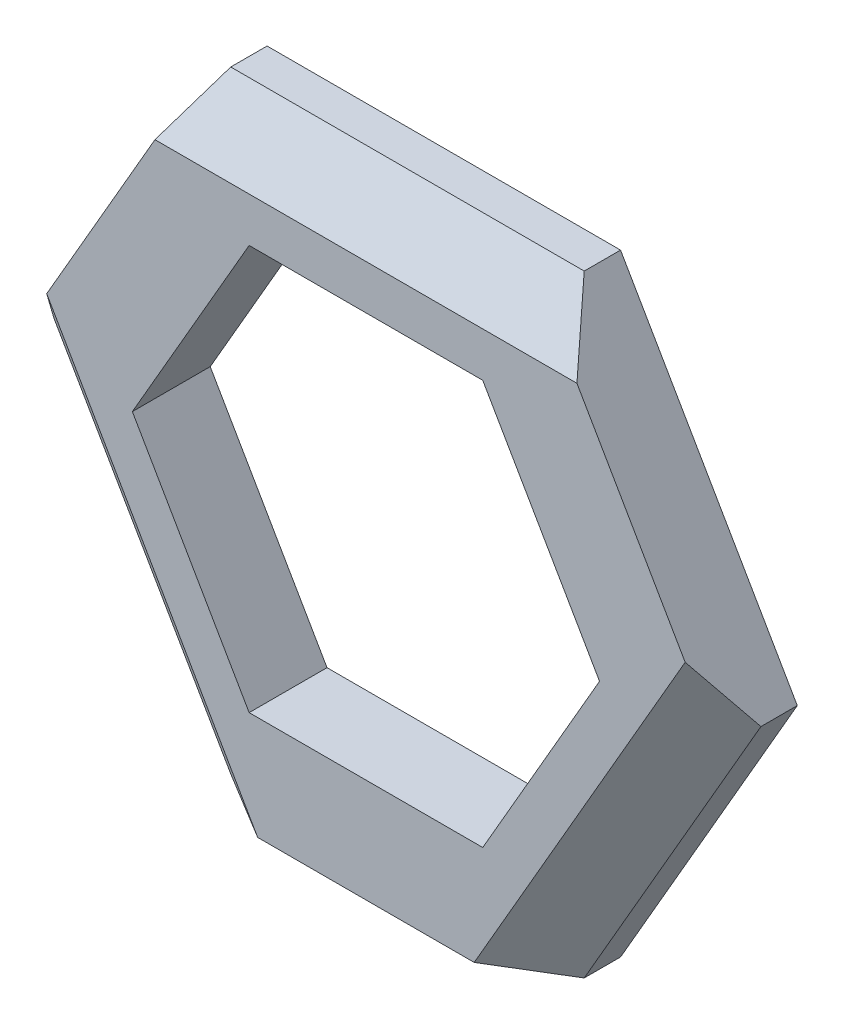
from build123d import *
from OCP.BRepFilletAPI import BRepFilletAPI_MakeChamfer

# Parameters (mm, degrees)
BOSS_EXTRUDE1_DEPTH = 15
CHAMFER1_SIZE       = 8
CHAMFER1_SIZE2      = 11.425184054


with BuildPart() as part:
    # Sketch1 → Boss-Extrude1 (new body)
    with BuildSketch(Plane.XY):
        Polygon((34.047005384, 58.97114317), (-34.047005384, 58.97114317), (-68.094010768, 0), (-34.047005384, -58.97114317), (34.047005384, -58.97114317), (68.094010768, 0), align=None)
        Polygon((45, 0), (22.5, 38.97114317), (-22.5, 38.97114317), (-45, 0), (-22.5, -38.97114317), (22.5, -38.97114317), align=None, mode=Mode.SUBTRACT)
    extrude(amount=BOSS_EXTRUDE1_DEPTH)

    # Chamfer1: one chamfer whose edges measure the first distance from different faces: ONE call of the kernel's chamfer builder (chamfer() names one face for all edges)
    chamfer1_edges_1 = [part.edges().sort_by_distance(p)[0] for p in [
        (-51.070508076, -29.485571585, 15),
    ]]
    chamfer1_side_1 = [part.faces().sort_by_distance(p)[0] for p in [
        (-51.070508076, -29.485571585, 7.5),
    ]]
    chamfer1_edges_2 = [part.edges().sort_by_distance(p)[0] for p in [
        (51.070508076, -29.485571585, 15),
    ]]
    chamfer1_side_2 = [part.faces().sort_by_distance(p)[0] for p in [
        (51.070508076, -29.485571585, 7.5),
    ]]
    chamfer1_edges_3 = [part.edges().sort_by_distance(p)[0] for p in [
        (0, 58.97114317, 15),
    ]]
    chamfer1_side_3 = [part.faces().sort_by_distance(p)[0] for p in [
        (0, 58.97114317, 7.5),
    ]]
    chamfer1 = BRepFilletAPI_MakeChamfer(part.part.solid().wrapped)
    for e in chamfer1_edges_1:
        chamfer1.Add(CHAMFER1_SIZE, CHAMFER1_SIZE2, e.wrapped, chamfer1_side_1[0].wrapped)  # the first distance lies on this face
    for e in chamfer1_edges_2:
        chamfer1.Add(CHAMFER1_SIZE, CHAMFER1_SIZE2, e.wrapped, chamfer1_side_2[0].wrapped)  # the first distance lies on this face
    for e in chamfer1_edges_3:
        chamfer1.Add(CHAMFER1_SIZE, CHAMFER1_SIZE2, e.wrapped, chamfer1_side_3[0].wrapped)  # the first distance lies on this face
    add(Compound.cast(chamfer1.Shape()), mode=Mode.REPLACE)


solid = part.part
